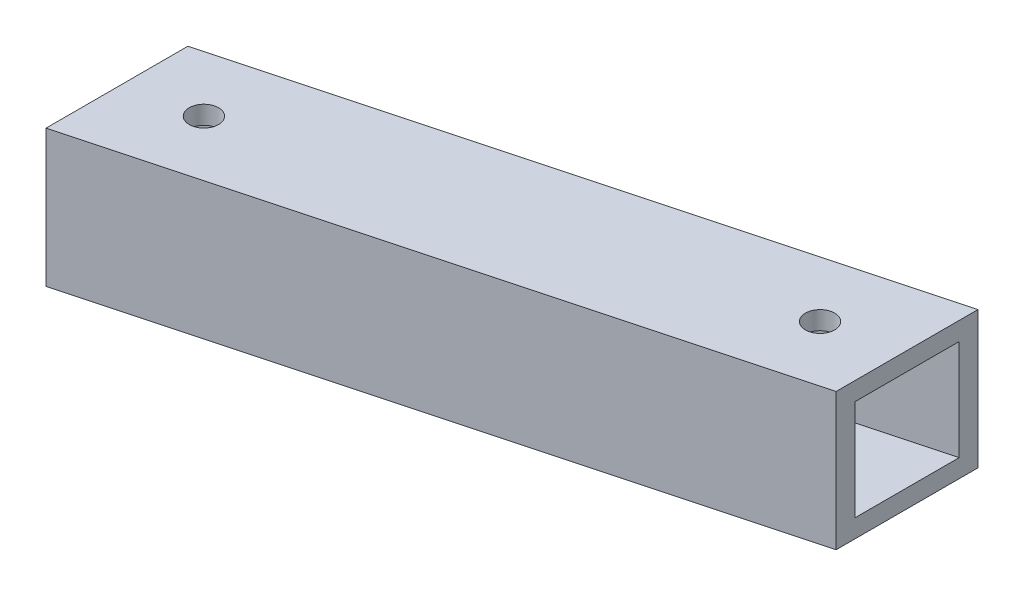
from build123d import *

# Parameters (mm, degrees)
BOSS_EXTRUDE1_DEPTH = 15
SKETCH2_W           = 11
SKETCH2_H           = 11
CUT_EXTRUDE1_DEPTH  = 80.765427423
CUT_EXTRUDE2_DEPTH  = 136.155378328
SKETCH4_R           = 1.6
CUT_EXTRUDE3_DEPTH  = 132.425469972


with BuildPart() as part:
    # Sketch1 → Boss-Extrude1 (new body)
    with BuildSketch(Plane(origin=(0, 0, 0), x_dir=(1, 0, 0), z_dir=(0, 1, 0))):
        Polygon((130, 19.30425231), (126.117714323, 33.793139704), (54.073263901, 14.488887394), (57.955549577, 0), align=None)
    extrude(amount=BOSS_EXTRUDE1_DEPTH)

    # Sketch2 → Cut-Extrude1 (cut, through all)
    with BuildSketch(Plane(origin=(54.073263901, 0, -14.488887394), x_dir=(-0.2588190451025183, 0, -0.965925826289069), z_dir=(0.965925826289069, 0, -0.2588190451025183))):
        with Locations((-7.5, 7.5)):
            Rectangle(SKETCH2_W, SKETCH2_H)
    extrude(amount=CUT_EXTRUDE1_DEPTH, mode=Mode.SUBTRACT)

    # Sketch3 → Cut-Extrude2 (cut, through all)
    with BuildSketch(Plane(origin=(0, 15, 0), x_dir=(1, 0, 0), z_dir=(0, 1, 0))):
        Polygon((126.117714323, 33.793139704), (126.117714323, 18.263996998), (130, 19.30425231), align=None)
        Polygon((54.073263901, 14.488887394), (57.955549577, 15.529142706), (57.955549577, 0), align=None)
    extrude(amount=-CUT_EXTRUDE2_DEPTH, mode=Mode.SUBTRACT)

    # Sketch4 → Cut-Extrude3 (cut, through all)
    with BuildSketch(Plane.XZ):
        with Locations(Location((118.617714323, -24.018949408, 0), (0, 0, 270))):
            Circle(SKETCH4_R)
        with Locations(Location((65.455549577, -9.774190296, 0), (0, 0, 270))):
            Circle(SKETCH4_R)
    extrude(amount=-CUT_EXTRUDE3_DEPTH, mode=Mode.SUBTRACT)


solid = part.part
